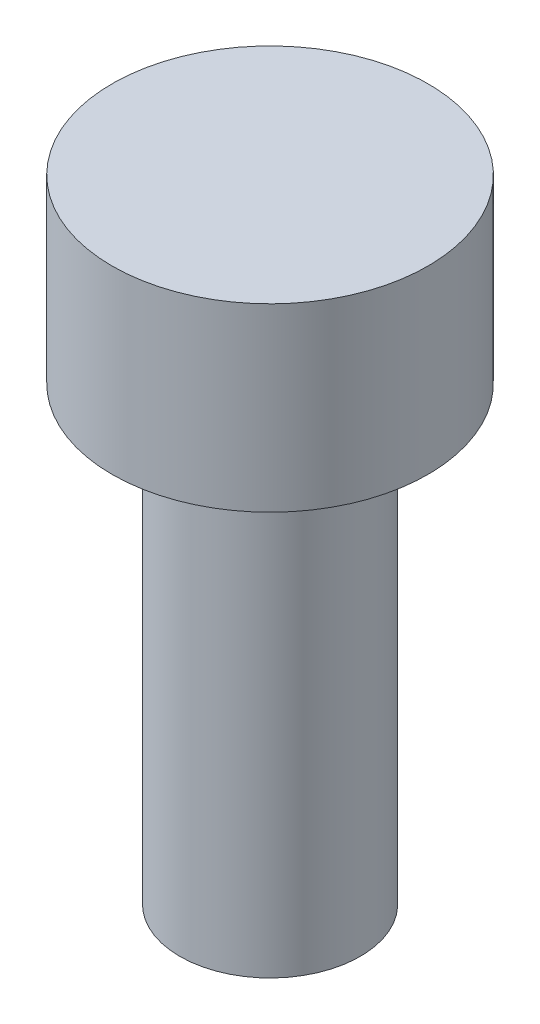
from build123d import *

# Parameters (mm, degrees)
SKETCH1_R           = 2
BOSS_EXTRUDE1_DEPTH = 10
SKETCH2_R           = 3.5
BOSS_EXTRUDE2_DEPTH = 4


with BuildPart() as part:
    # Sketch1 → Boss-Extrude1 (new body)
    with BuildSketch(Plane(origin=(0, 0, 0), x_dir=(1, 0, 0), z_dir=(0, 1, 0))):
        with Locations(Location((0, 0, 0), (0, 0, 270))):
            Circle(SKETCH1_R)
    extrude(amount=BOSS_EXTRUDE1_DEPTH)

    # Sketch2 → Boss-Extrude2 (add)
    with BuildSketch(Plane(origin=(0, 10, 0), x_dir=(1, 0, 0), z_dir=(0, 1, 0))):
        with Locations(Location((0, 0, 0), (0, 0, 270))):
            Circle(SKETCH2_R)
    extrude(amount=BOSS_EXTRUDE2_DEPTH)


solid = part.part
